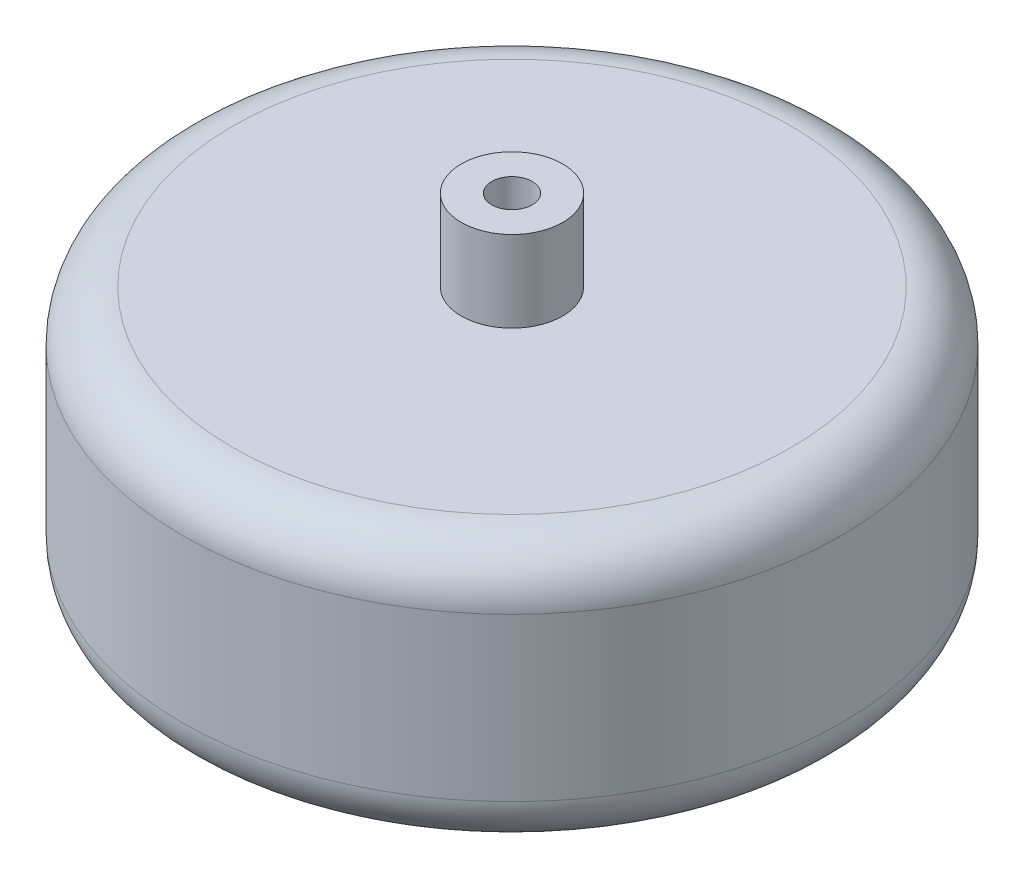
from build123d import *

# Parameters (mm, degrees)
SKETCH1_R           = 32.5
BOSS_EXTRUDE1_DEPTH = 26
SKETCH2_R           = 5
BOSS_EXTRUDE2_DEPTH = 8
SKETCH3_R           = 2
CUT_EXTRUDE1_DEPTH  = 8
FILLET1_R           = 5


with BuildPart() as part:
    # Sketch1 → Boss-Extrude1 (new body)
    with BuildSketch(Plane(origin=(0, 0, 0), x_dir=(1, 0, 0), z_dir=(0, 1, 0))):
        with Locations(Location((0, 0, 0), (0, 0, 90))):
            Circle(SKETCH1_R)
    extrude(amount=BOSS_EXTRUDE1_DEPTH)

    # Sketch2 → Boss-Extrude2 (add)
    with BuildSketch(Plane(origin=(0, 26, 0), x_dir=(1, 0, 0), z_dir=(0, 1, 0))):
        with Locations(Location((0, 0, 0), (0, 0, 270))):
            Circle(SKETCH2_R)
    extrude(amount=BOSS_EXTRUDE2_DEPTH)

    # Sketch3 → Cut-Extrude1 (cut)
    with BuildSketch(Plane(origin=(0, 34, 0), x_dir=(1, 0, 0), z_dir=(0, 1, 0))):
        with Locations(Location((0, 0, 0), (0, 0, 270))):
            Circle(SKETCH3_R)
    extrude(amount=-CUT_EXTRUDE1_DEPTH, mode=Mode.SUBTRACT)

    # Fillet1
    fillet1_edges = [part.edges().sort_by_distance(p)[0] for p in [
        (0, 0, 32.5),
        (0, 26, 32.5),
    ]]
    fillet(fillet1_edges, radius=FILLET1_R)


solid = part.part
